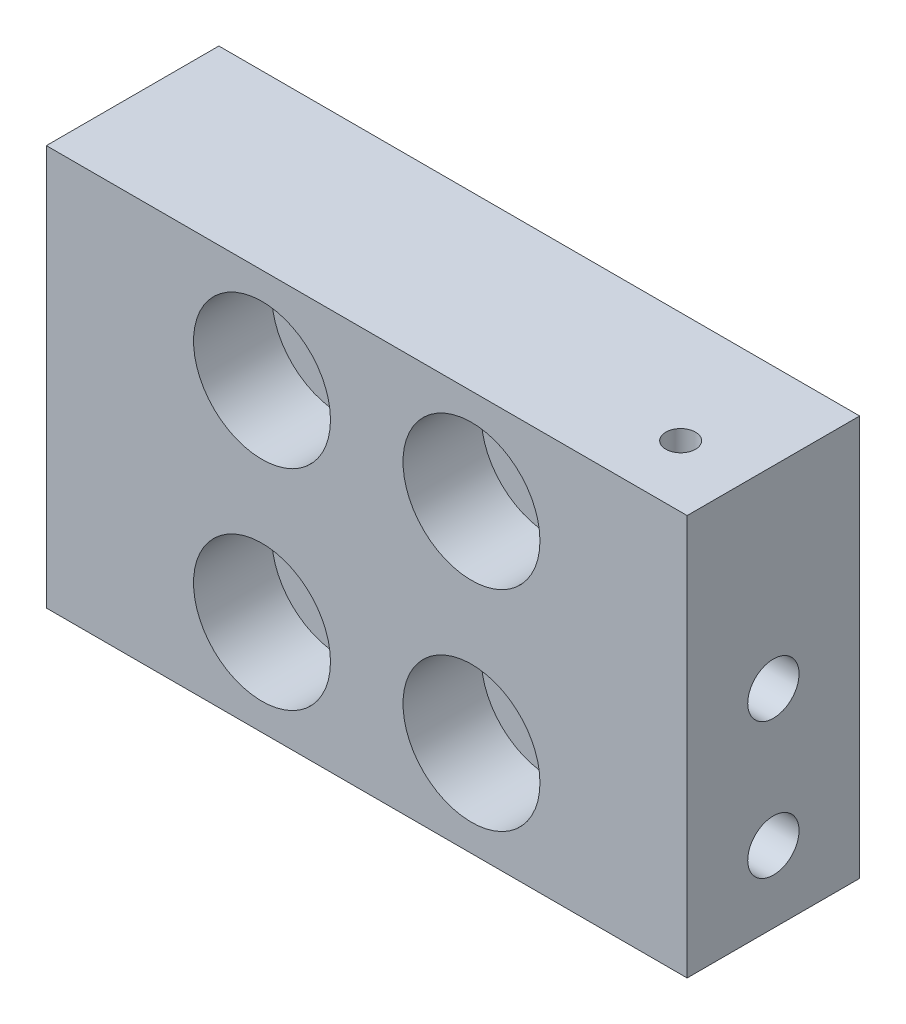
from build123d import *

# Parameters (mm, degrees)
SKETCH1_W                                        = 35
SKETCH1_H                                        = 32.5
BOSS_EXTRUDE1_DEPTH                              = 14
CBORE_FOR_1_4_SOCKET_HEAD_CAP_SCREW1_D           = 6.7564
CBORE_FOR_1_4_SOCKET_HEAD_CAP_SCREW1_CBORE_D     = 11.1125
CBORE_FOR_1_4_SOCKET_HEAD_CAP_SCREW1_CBORE_DEPTH = 6.35
SKETCH18_R                                       = 1.2065
SPRING_END_HOLE_DEPTH                            = 40.477841886
SKETCH19_W                                       = 17
SKETCH19_H                                       = 32.5
BOSS_EXTRUDE2_DEPTH                              = 14
CBORE_FOR_1_4_SOCKET_HEAD_CAP_SCREW2_D           = 6.7564
CBORE_FOR_1_4_SOCKET_HEAD_CAP_SCREW2_CBORE_D     = 11.1125
CBORE_FOR_1_4_SOCKET_HEAD_CAP_SCREW2_CBORE_DEPTH = 6.35
SKETCH22_R                                       = 2.0828
CUT_EXTRUDE1_DEPTH                               = 10


with BuildPart() as part:
    # Sketch1 → Boss-Extrude1 (new body)
    with BuildSketch(Plane.XY):
        Rectangle(SKETCH1_W, SKETCH1_H)
    extrude(amount=BOSS_EXTRUDE1_DEPTH)

    # CBORE for 1/4 Socket Head Cap Screw1 (through all)
    with Locations(Plane.XY.offset(14)):
        with Locations((0, -8.5), (0, 8.5)):
            CounterBoreHole(CBORE_FOR_1_4_SOCKET_HEAD_CAP_SCREW1_D / 2, CBORE_FOR_1_4_SOCKET_HEAD_CAP_SCREW1_CBORE_D / 2, CBORE_FOR_1_4_SOCKET_HEAD_CAP_SCREW1_CBORE_DEPTH)

    # Sketch18 → Spring-End Hole (cut, through all)
    with BuildSketch(Plane(origin=(0, 16.25, 0), x_dir=(1, 0, 0), z_dir=(0, 1, 0))):
        with Locations(Location((11.9761, -9, 0), (0, 0, 270))):
            Circle(SKETCH18_R)
    extrude(amount=-SPRING_END_HOLE_DEPTH, mode=Mode.SUBTRACT)

    # Sketch19 → Boss-Extrude2 (add)
    with BuildSketch(Plane.XY.offset(14)):
        with Locations((-26, 0)):
            Rectangle(SKETCH19_W, SKETCH19_H)
    extrude(amount=-BOSS_EXTRUDE2_DEPTH)

    # CBORE for 1/4 Socket Head Cap Screw2 (through all)
    with Locations(Plane.XY.offset(14)):
        with Locations((-17, 8.5), (-17, -8.5)):
            CounterBoreHole(CBORE_FOR_1_4_SOCKET_HEAD_CAP_SCREW2_D / 2, CBORE_FOR_1_4_SOCKET_HEAD_CAP_SCREW2_CBORE_D / 2, CBORE_FOR_1_4_SOCKET_HEAD_CAP_SCREW2_CBORE_DEPTH)

    # Sketch22 → Cut-Extrude1 (cut)
    with BuildSketch(Plane.ZY.offset(34.5)):
        with Locations((7, 0.5882)):
            Circle(SKETCH22_R)
        with Locations((7, -10.4354)):
            Circle(SKETCH22_R)
    cut_extrude1 = extrude(amount=-CUT_EXTRUDE1_DEPTH, mode=Mode.SUBTRACT)

    # Mirror1: Cut-Extrude1 across plane
    add(cut_extrude1.mirror(Plane(origin=(-8.5, 0, 0), x_dir=(0, 0, 1), z_dir=(1, 0, 0))), mode=Mode.SUBTRACT)


solid = part.part
